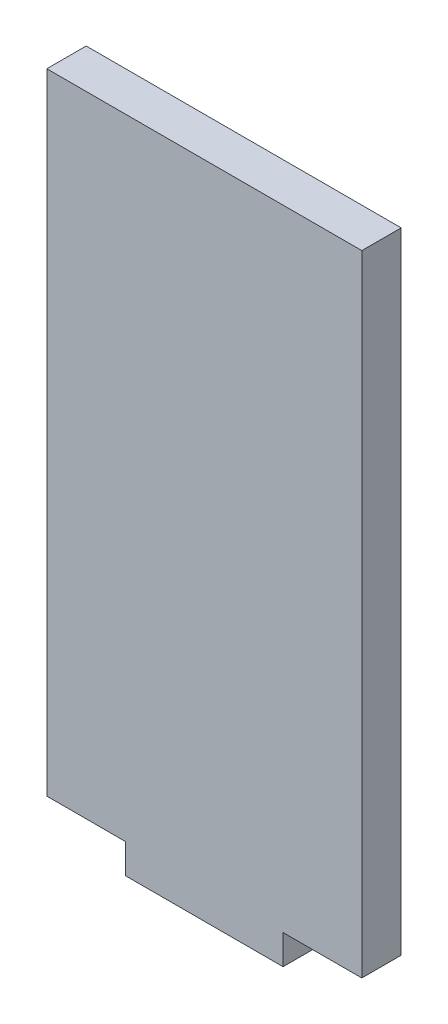
from build123d import *

# Parameters (mm, degrees)
BOSS_EXTRUDE1_DEPTH = 3.175


with BuildPart() as part:
    # Sketch1 → Boss-Extrude1 (new body)
    with BuildSketch(Plane.XY):
        Polygon((6.35, 0), (6.35, -2.387934918), (19.05, -2.387934918), (19.05, 0), (25.4, 0), (25.4, 50.8), (0, 50.8), (0, 0), align=None)
    extrude(amount=BOSS_EXTRUDE1_DEPTH)


solid = part.part
